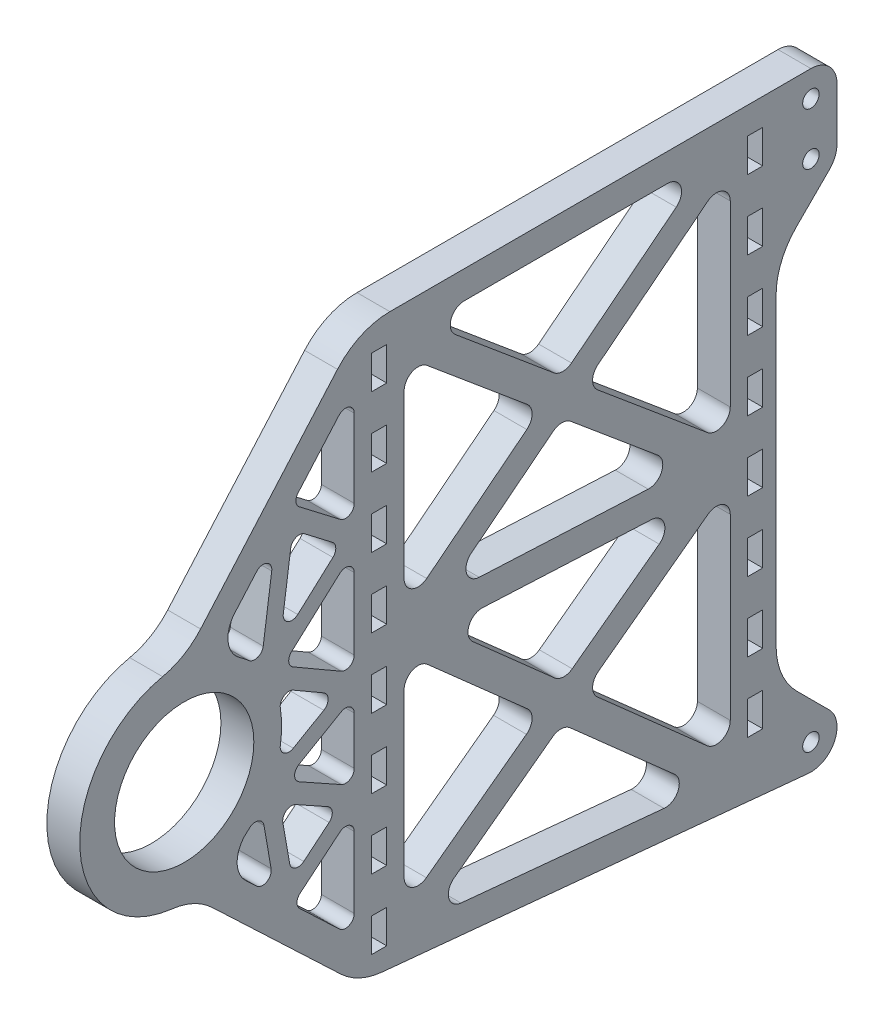
from build123d import *

# Parameters (mm, degrees)
SKETCH4_R               = 1.5
SKETCH4_R_2             = 12.7
BOSS_EXTRUDE1_DEPTH     = 3
SKETCH5_W               = 2.75
SKETCH5_H               = 6.096
LOWERSLOT_DEPTH         = 115.203880872
SKETCH5_3_W             = 2.75
SKETCH5_3_H             = 6.096
UPPERSLOT_DEPTH         = 115.203880872
LOWERSLOTS_COUNT        = 8
LOWERSLOTS_PITCH        = 12.7
UPPERSLOTS_COUNT        = 8
UPPERSLOTS_PITCH        = 12.7
CUT_EXTRUDE1_DEPTH      = 115.203880872
CUT_EXTRUDE1_DEPTH_BACK = 115.203880872
CUT_EXTRUDE2_DEPTH      = 115.203880872
CUT_EXTRUDE2_DEPTH_BACK = 115.203880872
FILLET1_R               = 1.5875
FILLET2_R               = 2.54
FILLET3_R               = 12.7


with BuildPart() as part:
    # Sketch4 → Boss-Extrude1 (new, symmetric)
    with BuildSketch(Plane(origin=(0, 0, 0), x_dir=(0, 0, -1), z_dir=(1, 0, 0))):
        with BuildLine():
            ThreePointArc((47.817596045, 22.032403955), (48.849976274, 23.577470153), (49.2125, 25.4))
            Line((49.2125, 25.4), (49.2125, 34.925))
            ThreePointArc((49.2125, 34.925), (47.817596045, 38.292596045), (44.45, 39.6875))
            Line((44.45, 39.6875), (-38.1, 39.6875))
            Line((-38.1, 39.6875), (-70.055729146, 3.173889089))
            ThreePointArc((-70.055729146, 3.173889089), (-88.879489323, -16.758762477), (-68.289324669, -34.860963039))
            Line((-68.289324669, -34.860963039), (-38.1, -63.5))
            Line((-38.1, -63.5), (43.992912904, -71.415514491))
            ThreePointArc((43.992912904, -71.415514491), (48.757334408, -68.706816071), (47.817596045, -63.307403955))
            Line((47.817596045, -63.307403955), (38.1, -53.589807909))
            Line((38.1, -53.589807909), (38.1, 12.314807909))
            Line((38.1, 12.314807909), (47.817596045, 22.032403955))
        make_face()
        with Locations((44.45, -66.675)):
            Circle(SKETCH4_R, mode=Mode.SUBTRACT)
        with Locations((44.45, 25.4)):
            Circle(SKETCH4_R, mode=Mode.SUBTRACT)
        with Locations((44.45, 34.925)):
            Circle(SKETCH4_R, mode=Mode.SUBTRACT)
        with Locations((-69.85, -15.875)):
            Circle(SKETCH4_R_2, mode=Mode.SUBTRACT)
    extrude(amount=BOSS_EXTRUDE1_DEPTH, both=True)

    # Sketch5 → LowerSlot (cut, symmetric)
    with BuildSketch(Plane(origin=(3, 0, 0), x_dir=(0, 0, -1), z_dir=(1, 0, 0))):
        with Locations((34.29, -57.15)):
            Rectangle(SKETCH5_W, SKETCH5_H)
    lowerslot = extrude(amount=LOWERSLOT_DEPTH, both=True, mode=Mode.SUBTRACT)

    # Sketch5<3> → UpperSlot (cut, symmetric)
    with BuildSketch(Plane(origin=(3, 0, 0), x_dir=(0, 0, -1), z_dir=(1, 0, 0))):
        with Locations((-34.29, -57.15)):
            Rectangle(SKETCH5_3_W, SKETCH5_3_H)
    upperslot = extrude(amount=UPPERSLOT_DEPTH, both=True, mode=Mode.SUBTRACT)

    # LowerSlots: LowerSlot ×8
    with Locations(*[(0, i * LOWERSLOTS_PITCH, 0) for i in range(1, LOWERSLOTS_COUNT)]):
        add(lowerslot, mode=Mode.SUBTRACT)

    # UpperSlots: UpperSlot ×8
    with Locations(*[(0, i * UPPERSLOTS_PITCH, 0) for i in range(1, UPPERSLOTS_COUNT)]):
        add(upperslot, mode=Mode.SUBTRACT)

    # Sketch6 → Cut-Extrude1 (cut, two sides: drawn at the far end of the back side and taken through both)
    with BuildSketch(Plane(origin=(3, 0, 0), x_dir=(0, 0, -1), z_dir=(1, 0, 0)).offset(-CUT_EXTRUDE1_DEPTH_BACK)):
        Polygon((-50.087511874, -45.125900306), (-38.84, -55.795827898), (-38.84, -35.776127904), align=None)
        Polygon((-51.343941952, -24.927241356), (-38.84, -31.894451773), (-38.84, -17.708087105), align=None)
        with BuildLine():
            Line((-58.612352068, -37.03882926), (-53.17660617, -42.195437744))
            Line((-53.17660617, -42.195437744), (-55.846264923, -26.83053759))
            ThreePointArc((-55.846264923, -26.83053759), (-57.050112991, -28.215635824), (-58.390319528, -29.469268038))
            ThreePointArc((-58.390319528, -29.469268038), (-60.193941143, -33.204400664), (-58.612352068, -37.03882926))
        make_face()
        Polygon((-51.881263083, -6.512536144), (-38.84, -14.041912895), (-38.84, 5.299818262), align=None)
        Polygon((-38.84, 9.441875068), (-38.84, 31.128368318), (-50.199617302, 18.148515961), align=None)
        with BuildLine():
            ThreePointArc((-53.308781878, -9.354531993), (-52.07, -15.875), (-53.308781878, -22.395468007))
            Line((-53.308781878, -22.395468007), (-42.015, -15.875))
            Line((-42.015, -15.875), (-53.308781878, -9.354531993))
        make_face()
        with BuildLine():
            Line((-53.154257113, 14.772452534), (-60.622262369, 6.239277248))
            ThreePointArc((-60.622262369, 6.239277248), (-61.841655165, 2.274766197), (-59.699611627, -1.277122898))
            ThreePointArc((-59.699611627, -1.277122898), (-57.664325382, -2.927500856), (-55.893705384, -4.859091476))
            Line((-55.893705384, -4.859091476), (-53.154257113, 14.772452534))
        make_face()
        Polygon((-41.63563821, -33.97132875), (-52.427813194, -27.957916799), (-50.152807855, -41.051436651), align=None)
        Polygon((-41.31697613, 7.340050944), (-50.051450997, 14.034637041), (-52.384500329, -2.684554603), align=None)
    extrude(amount=CUT_EXTRUDE1_DEPTH + CUT_EXTRUDE1_DEPTH_BACK, mode=Mode.SUBTRACT)

    # Sketch6<3> → Cut-Extrude2 (cut, two sides: drawn at the far end of the back side and taken through both)
    with BuildSketch(Plane(origin=(3, 0, 0), x_dir=(0, 0, -1), z_dir=(1, 0, 0)).offset(-CUT_EXTRUDE2_DEPTH_BACK)):
        Polygon((3.149088574, -38.012691038), (29.74, -61.545807265), (29.74, -18.325474608), align=None)
        Polygon((-25.963221683, -59.566685318), (25.438798432, -64.522940623), (-1.024534227, -41.10273237), align=None)
        Polygon((-22.64769031, -15.182386878), (-0.739713492, -34.571077867), (22.507623782, -17.359356426), align=None)
        Polygon((-29.74, -56.04213269), (-4.913336293, -37.661119199), (-29.74, -15.689372794), align=None)
        Polygon((3.145690553, 10.400884111), (29.74, -11.853108965), (29.74, 31.372746767), align=None)
        Polygon((-22.835439989, -10.087435109), (22.315399668, -12.264188941), (-0.92963403, 7.187145939), align=None)
        Polygon((-25.782072273, 34.6075), (-0.834613689, 13.731583982), (25.638026328, 34.6075), align=None)
        Polygon((-29.74, -9.062758279), (-4.909938272, 10.51784581), (-29.74, 31.295524691), align=None)
    extrude(amount=CUT_EXTRUDE2_DEPTH + CUT_EXTRUDE2_DEPTH_BACK, mode=Mode.SUBTRACT)

    # Fillet1
    fillet1_edges = [part.edges().sort_by_distance(p)[0] for p in [
        (0, 9.441875068, 38.84),
        (0, 31.128368318, 38.84),
        (0, 18.148515961, 50.199617302),
        (0, -4.859091476, 55.893705384),
        (0, 14.772452534, 53.154257113),
        (0, 7.340050944, 41.31697613),
        (0, 14.034637041, 50.051450997),
        (0, -2.684554603, 52.384500329),
        (0, -6.512536144, 51.881263083),
        (0, -14.041912895, 38.84),
        (0, 5.299818262, 38.84),
        (0, -22.395468007, 53.308781878),
        (0, -15.875, 42.015),
        (0, -9.354531993, 53.308781878),
        (0, -42.195437744, 53.17660617),
        (0, -26.83053759, 55.846264923),
        (0, -17.708087105, 38.84),
        (0, -24.927241356, 51.343941952),
        (0, -31.894451773, 38.84),
        (0, -27.957916799, 52.427813194),
        (0, -41.051436651, 50.152807855),
        (0, -33.97132875, 41.63563821),
        (0, -55.795827898, 38.84),
        (0, -35.776127904, 38.84),
        (0, -45.125900306, 50.087511874),
    ]]
    fillet(fillet1_edges, radius=FILLET1_R)

    # Fillet2
    fillet2_edges = [part.edges().sort_by_distance(p)[0] for p in [
        (0, 13.731583982, 0.834613689),
        (0, 34.6075, -25.638026328),
        (0, 34.6075, 25.782072273),
        (0, -11.853108965, -29.74),
        (0, 31.372746767, -29.74),
        (0, 10.400884111, -3.145690553),
        (0, 10.51784581, 4.909938272),
        (0, 31.295524691, 29.74),
        (0, -9.062758279, 29.74),
        (0, -12.264188941, -22.315399668),
        (0, 7.187145939, 0.92963403),
        (0, -10.087435109, 22.835439989),
        (0, -34.571077867, 0.739713492),
        (0, -17.359356426, -22.507623782),
        (0, -15.182386878, 22.64769031),
        (0, -38.012691038, -3.149088574),
        (0, -61.545807265, -29.74),
        (0, -18.325474608, -29.74),
        (0, -56.04213269, 29.74),
        (0, -37.661119199, 4.913336293),
        (0, -59.566685318, 25.963221683),
        (0, -64.522940623, -25.438798432),
        (0, -41.10273237, 1.024534227),
        (0, -15.689372794, 29.74),
    ]]
    fillet(fillet2_edges, radius=FILLET2_R)

    # Fillet3
    fillet3_edges = [part.edges().sort_by_distance(p)[0] for p in [
        (0, 12.314807909, -38.1),
        (0, -53.589807909, -38.1),
        (0, 39.6875, 38.1),
        (0, 3.173889089, 70.055729146),
        (0, -34.860963039, 68.289324669),
        (0, -63.5, 38.1),
    ]]
    fillet(fillet3_edges, radius=FILLET3_R)


solid = part.part
